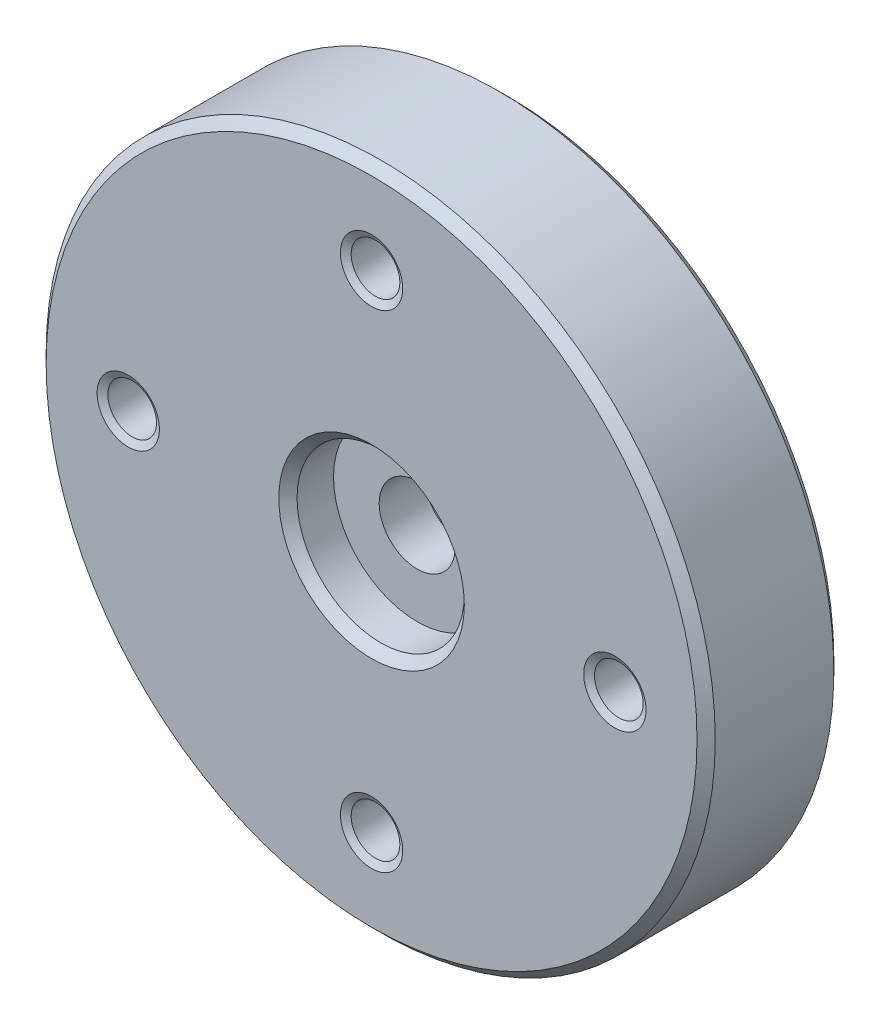
from build123d import *

# Parameters (mm, degrees)
M2_TAPPED_HOLE1_AT_2_COUNT = 2
M2_TAPPED_HOLE1_AT_2_PITCH = 11.313708499
M2_TAPPED_HOLE1_AT_3_COUNT = 2
M2_TAPPED_HOLE1_AT_3_PITCH = 16
M2_TAPPED_HOLE1_AT_4_COUNT = 2
M2_TAPPED_HOLE1_AT_4_PITCH = 11.313708499
M2_TAPPED_HOLE1_AT_5_COUNT = 2
M2_TAPPED_HOLE1_AT_5_PITCH = 8
CHAMFER1_SIZE              = 0.3


with BuildPart() as part:
    # Sketch1 → Revolve1 (revolve)
    with BuildSketch(Plane(origin=(0, 0, 0), x_dir=(0, 0, -1), z_dir=(1, 0, 0)), mode=Mode.PRIVATE) as revolve1_sk:
        Polygon((3, 1.25), (1.5, 1.25), (1.5, 2.75), (0, 2.75), (0, 11), (4.5, 11), (4.5, 4.5), (6.7, 4.5), (6.7, 2.75), (3, 2.75), align=None)
    revolve(revolve1_sk.sketch.rotate(Axis((0, 0, 0), (0, 0, 1)), 90), axis=Axis((0, 0, 0), (0, 0, 1)))

    # Sketch4 → M2 Tapped Hole1 (revolve, cut)
    with BuildSketch(Plane(origin=(0, 8, 0), x_dir=(0, -1, 0), z_dir=(1, 0, 0))):
        Polygon((0, 0), (0, 4.5), (1.025, 4.5), (0.8, 4.370096189), (0.8, 0.129903811), (1.025, 0), align=None)
    m2_tapped_hole1 = revolve(axis=Axis((0, 8, 6.35), (0, 0, -1)), mode=Mode.SUBTRACT)

    # M2 Tapped Hole1 at 2: M2 Tapped Hole1 ×2
    with Locations(*[Vector(0.7071067811865476, -0.7071067811865476, 0) * (i * M2_TAPPED_HOLE1_AT_2_PITCH) for i in range(1, M2_TAPPED_HOLE1_AT_2_COUNT)]):
        add(m2_tapped_hole1, mode=Mode.SUBTRACT)

    # M2 Tapped Hole1 at 3: M2 Tapped Hole1 ×2
    with Locations(*[(0, -i * M2_TAPPED_HOLE1_AT_3_PITCH, 0) for i in range(1, M2_TAPPED_HOLE1_AT_3_COUNT)]):
        add(m2_tapped_hole1, mode=Mode.SUBTRACT)

    # M2 Tapped Hole1 at 4: M2 Tapped Hole1 ×2
    with Locations(*[Vector(-0.7071067811865476, -0.7071067811865475, 0) * (i * M2_TAPPED_HOLE1_AT_4_PITCH) for i in range(1, M2_TAPPED_HOLE1_AT_4_COUNT)]):
        add(m2_tapped_hole1, mode=Mode.SUBTRACT)

    # M2 Tapped Hole1 at 5: M2 Tapped Hole1 ×2
    with Locations(*[(0, -i * M2_TAPPED_HOLE1_AT_5_PITCH, 0) for i in range(1, M2_TAPPED_HOLE1_AT_5_COUNT)]):
        add(m2_tapped_hole1, mode=Mode.SUBTRACT)

    # Chamfer1
    chamfer1_edges = [part.edges().sort_by_distance(p)[0] for p in [
        (11, 0, -4.5),
        (11, 0, 0),
        (2.75, 0, 0),
        (4.5, 0, -6.7),
    ]]
    chamfer(chamfer1_edges, length=CHAMFER1_SIZE)


solid = part.part
